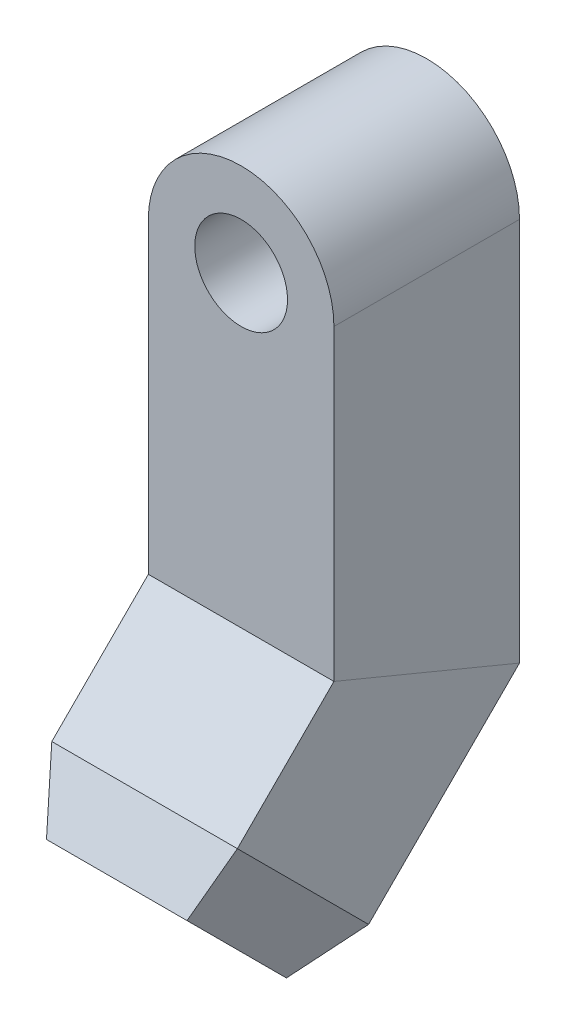
from build123d import *

# Parameters (mm, degrees)
SKETCH11_W          = 38.1
SKETCH11_H          = 38.1
SKETCH12_W          = 38.1
SKETCH12_H          = 38.1
BOSS_EXTRUDE5_DEPTH = 12.7
BOSS_EXTRUDE5_TAPER = 20
BOSS_EXTRUDE6_DEPTH = 38.1
SKETCH14_R          = 9.525
CUT_EXTRUDE2_DEPTH  = 38.1
SKETCH15_R          = 9.525
CUT_EXTRUDE3_DEPTH  = 12.7


with BuildPart() as part:
    # Sweep1: sweep along a path in Sketch10
    with BuildLine(Plane(origin=(0, 0, 0), x_dir=(0, 0, -1), z_dir=(1, 0, 0))) as sweep1_path:
        Line((0, 96.393), (0, 25.4))
        Line((0, 25.4), (-25.4, 0))
    # Sketch11 → Sweep1 (sweep)
    with BuildSketch(Plane(origin=(0, 96.393, 0), x_dir=(1, 0, 0), z_dir=(0, 1, 0))):
        Rectangle(SKETCH11_W, SKETCH11_H)
    sweep(path=sweep1_path.line, transition=Transition.RIGHT)

    # Sketch12 → Boss-Extrude5 (add)
    with BuildSketch(Plane(origin=(0, -12.7, 12.7), x_dir=(1, 0, 0), z_dir=(0, -0.7071067811865461, 0.7071067811865489))):
        with Locations((0, 17.960512242)):
            Rectangle(SKETCH12_W, SKETCH12_H)
    extrude(amount=BOSS_EXTRUDE5_DEPTH, taper=BOSS_EXTRUDE5_TAPER)

    # Sketch13 → Boss-Extrude6 (add)
    with BuildSketch(Plane(origin=(0, 0, -19.05), x_dir=(-1, 0, 0), z_dir=(0, 0, -1))):
        with BuildLine():
            Line((-19.05, 96.393), (19.05, 96.393))
            ThreePointArc((19.05, 96.393), (0, 115.443), (-19.05, 96.393))
        make_face()
    extrude(amount=-BOSS_EXTRUDE6_DEPTH)

    # Sketch14 → Cut-Extrude2 (cut)
    with BuildSketch(Plane.XY.offset(19.05)):
        with Locations((0, 96.393)):
            Circle(SKETCH14_R)
    extrude(amount=-CUT_EXTRUDE2_DEPTH, mode=Mode.SUBTRACT)

    # Sketch15 → Cut-Extrude3 (cut)
    with BuildSketch(Plane(origin=(0, -21.680256121, 21.680256121), x_dir=(1, 0, 0), z_dir=(0, -0.7071067811865461, 0.7071067811865489))):
        with Locations(Location((0, 17.960512242, 0), (0, 0, 270))):
            Circle(SKETCH15_R)
    extrude(amount=-CUT_EXTRUDE3_DEPTH, mode=Mode.SUBTRACT)


solid = part.part
